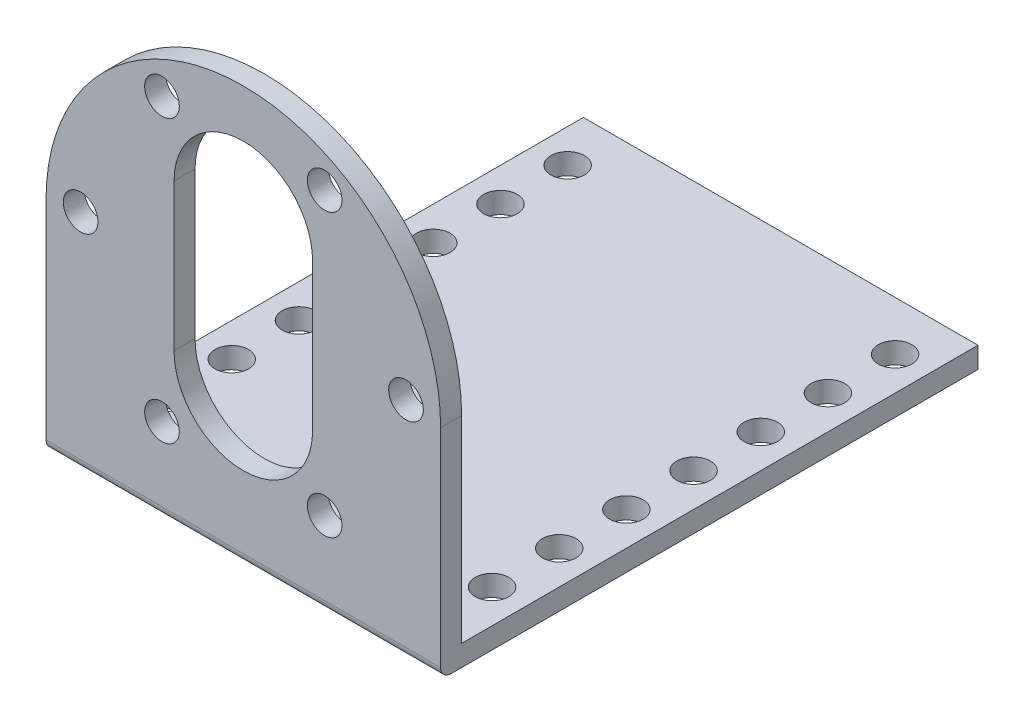
from build123d import *

# Parameters (mm, degrees)
BOSS_EXTRUDE1_DEPTH = 37.6
CUT_EXTRUDE1_DEPTH  = 69.310699879
SKETCH4_R           = 1.6
CUT_EXTRUDE2_DEPTH  = 81.972748235
SKETCH5_R           = 1.65
CUT_EXTRUDE4_DEPTH  = 69.310699879
CUT_EXTRUDE5_DEPTH  = 69.310699879


with BuildPart() as part:
    # Sketch1 → Boss-Extrude1 (new body)
    with BuildSketch(Plane(origin=(0, 0, 0), x_dir=(0, 0, -1), z_dir=(1, 0, 0))):
        with BuildLine():
            Line((-9.866078609, -8.756426748), (-59.066078609, -8.756426748))
            Line((-59.066078609, -8.756426748), (-59.066078609, 28.843573252))
            Line((-59.066078609, 28.843573252), (-61.066078609, 28.843573252))
            Line((-61.066078609, 28.843573252), (-61.066078609, -9.756426748))
            ThreePointArc((-61.066078609, -9.756426748), (-60.77318539, -10.463533529), (-60.066078609, -10.756426748))
            Line((-60.066078609, -10.756426748), (-9.866078609, -10.756426748))
            Line((-9.866078609, -10.756426748), (-9.866078609, -8.756426748))
        make_face()
    extrude(amount=BOSS_EXTRUDE1_DEPTH)

    # Sketch3 → Cut-Extrude1 (cut, through all)
    with BuildSketch(Plane(origin=(0, 0, 59.066078609), x_dir=(-1, 0, 0), z_dir=(0, 0, -1))):
        with BuildLine():
            Line((-12.2, 3.689945041), (-12.2, 17.689945041))
            ThreePointArc((-12.2, 17.689945041), (-18.8, 24.289945041), (-25.4, 17.689945041))
            Line((-25.4, 17.689945041), (-25.4, 3.689945041))
            ThreePointArc((-25.4, 3.689945041), (-18.8, -2.910054959), (-12.2, 3.689945041))
        make_face()
    extrude(amount=-CUT_EXTRUDE1_DEPTH, mode=Mode.SUBTRACT)

    # Sketch4 → Cut-Extrude2 (cut, through all)
    with BuildSketch(Plane(origin=(0, -8.756426748, 0), x_dir=(1, 0, 0), z_dir=(0, 1, 0))):
        with Locations((34.4, -14.566078609)):
            Circle(SKETCH4_R)
        with Locations((34.4, -20.966078609)):
            Circle(SKETCH4_R)
        with Locations((34.4, -27.366078609)):
            Circle(SKETCH4_R)
        with Locations((34.4, -33.766078609)):
            Circle(SKETCH4_R)
        with Locations((34.4, -40.166078609)):
            Circle(SKETCH4_R)
        with Locations((34.4, -46.566078609)):
            Circle(SKETCH4_R)
        with Locations((34.4, -52.966078609)):
            Circle(SKETCH4_R)
        with Locations((3.2, -52.966078609)):
            Circle(SKETCH4_R)
        with Locations((3.2, -46.566078609)):
            Circle(SKETCH4_R)
        with Locations((3.2, -40.166078609)):
            Circle(SKETCH4_R)
        with Locations((3.2, -33.766078609)):
            Circle(SKETCH4_R)
        with Locations((3.2, -27.366078609)):
            Circle(SKETCH4_R)
        with Locations((3.2, -20.966078609)):
            Circle(SKETCH4_R)
        with Locations((3.2, -14.566078609)):
            Circle(SKETCH4_R)
    extrude(amount=-CUT_EXTRUDE2_DEPTH, mode=Mode.SUBTRACT)

    # Sketch5 → Cut-Extrude4 (cut, through all)
    with BuildSketch(Plane(origin=(0, 0, 59.066078609), x_dir=(-1, 0, 0), z_dir=(0, 0, -1))):
        with Locations((-11.05, -2.733448718)):
            Circle(SKETCH5_R)
        with Locations((-3.3, 10.689945041)):
            Circle(SKETCH5_R)
        with Locations((-26.55, -2.733448718)):
            Circle(SKETCH5_R)
        with Locations((-34.3, 10.689945041)):
            Circle(SKETCH5_R)
        with Locations((-26.55, 24.1133388)):
            Circle(SKETCH5_R)
        with Locations((-11.05, 24.1133388)):
            Circle(SKETCH5_R)
    extrude(amount=-CUT_EXTRUDE4_DEPTH, mode=Mode.SUBTRACT)

    # Sketch6 → Cut-Extrude5 (cut, through all)
    with BuildSketch(Plane(origin=(0, 0, 59.066078609), x_dir=(-1, 0, 0), z_dir=(0, 0, -1))):
        with BuildLine():
            Line((0, 28.843573252), (-18.8, 28.843573252))
            ThreePointArc((-18.8, 28.843573252), (-5.506392514, 23.337180738), (0, 10.043573252))
            Line((0, 10.043573252), (0, 28.843573252))
        make_face()
        with BuildLine():
            Line((-37.6, 28.843573252), (-37.6, 10.043573252))
            ThreePointArc((-37.6, 10.043573252), (-32.093607486, 23.337180738), (-18.8, 28.843573252))
            Line((-18.8, 28.843573252), (-37.6, 28.843573252))
        make_face()
    extrude(amount=-CUT_EXTRUDE5_DEPTH, mode=Mode.SUBTRACT)


solid = part.part
